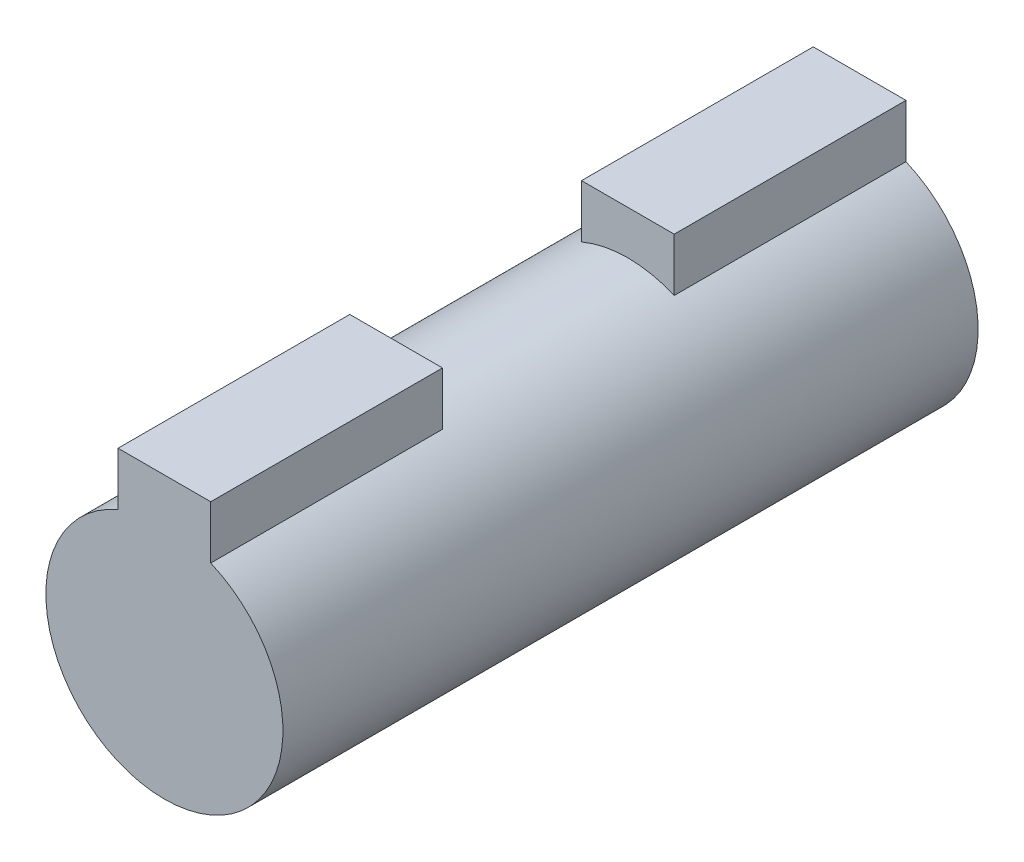
from build123d import *

# Parameters (mm, degrees)
BOSS_EXTRUDE1_DEPTH = 30
CUT_EXTRUDE1_START  = -20
SKETCH2_R           = 7.822470446
SKETCH2_R_2         = 5.115
CUT_EXTRUDE1_DEPTH  = 10


with BuildPart() as part:
    # Sketch1 → Boss-Extrude1 (new body)
    with BuildSketch(Plane.XY):
        with BuildLine():
            Line((-2, 4.707783449), (-2, 7))
            Line((-2, 7), (2, 7))
            Line((2, 7), (2, 4.707783449))
            ThreePointArc((2, 4.707783449), (0, -5.115), (-2, 4.707783449))
        make_face()
    extrude(amount=BOSS_EXTRUDE1_DEPTH)

    # Sketch2 → Cut-Extrude1 (cut)
    with BuildSketch(Plane.XY.offset(30).offset(CUT_EXTRUDE1_START)):
        Circle(SKETCH2_R)
        with Locations(Location((0, 0, 0), (0, 0, 113.017162604))):
            Circle(SKETCH2_R_2, mode=Mode.SUBTRACT)
    extrude(amount=CUT_EXTRUDE1_DEPTH, mode=Mode.SUBTRACT)


solid = part.part
